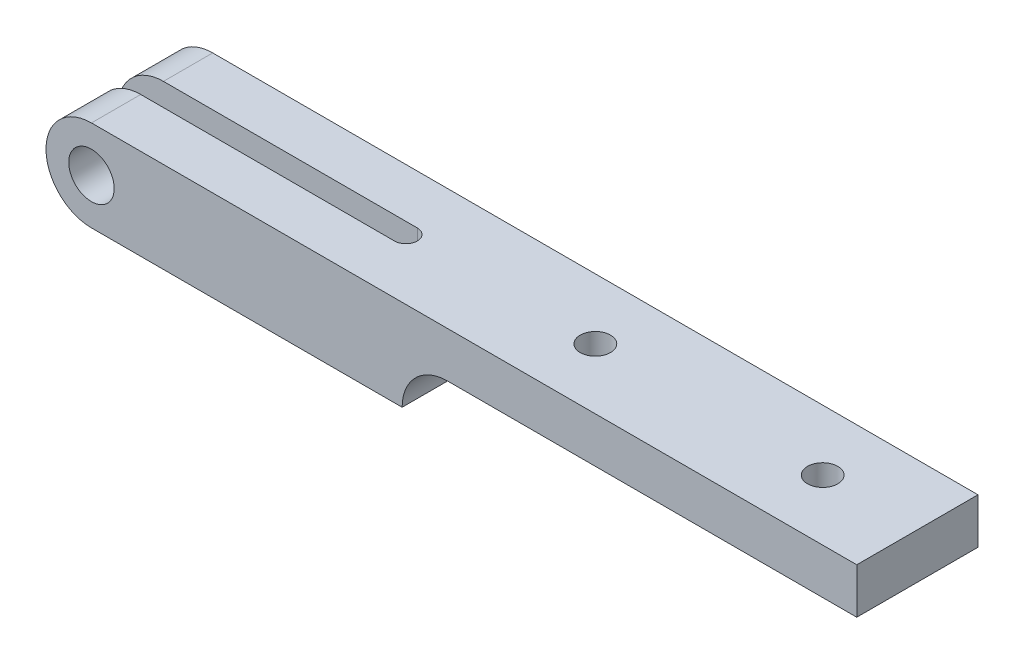
from build123d import *

# Parameters (mm, degrees)
SKETCH2_R           = 3
BOSS_EXTRUDE1_DEPTH = 8
SKETCH3_R           = 2
CUT_EXTRUDE1_DEPTH  = 103.02450686


with BuildPart() as part:
    # Sketch2 → Boss-Extrude1 (new, symmetric)
    with BuildSketch(Plane.XY):
        with BuildLine():
            Line((0, -6), (41, -6))
            ThreePointArc((41, -6), (42.757359313, -1.757359313), (47, 0))
            Line((47, 0), (101, 0))
            Line((101, 0), (101, 6))
            Line((101, 6), (0, 6))
            ThreePointArc((0, 6), (-6, 0), (0, -6))
        make_face()
        Circle(SKETCH2_R, mode=Mode.SUBTRACT)
    extrude(amount=BOSS_EXTRUDE1_DEPTH, both=True)

    # Sketch3 → Cut-Extrude1 (cut, through all)
    with BuildSketch(Plane(origin=(0, 6, 0), x_dir=(1, 0, 0), z_dir=(0, 1, 0))):
        with Locations(Location((58.5, 0, 0), (0, 0, 270))):
            Circle(SKETCH3_R)
        with Locations(Location((88.5, 0, 0), (0, 0, 270))):
            Circle(SKETCH3_R)
        with BuildLine():
            Line((33.49999953, -1.5), (-6, -1.5))
            Line((-6, -1.5), (-6, 1.5))
            Line((-6, 1.5), (33.49999953, 1.5))
            ThreePointArc((33.49999953, 1.5), (35, 0), (33.49999953, -1.5))
        make_face()
    extrude(amount=-CUT_EXTRUDE1_DEPTH, mode=Mode.SUBTRACT)


solid = part.part
